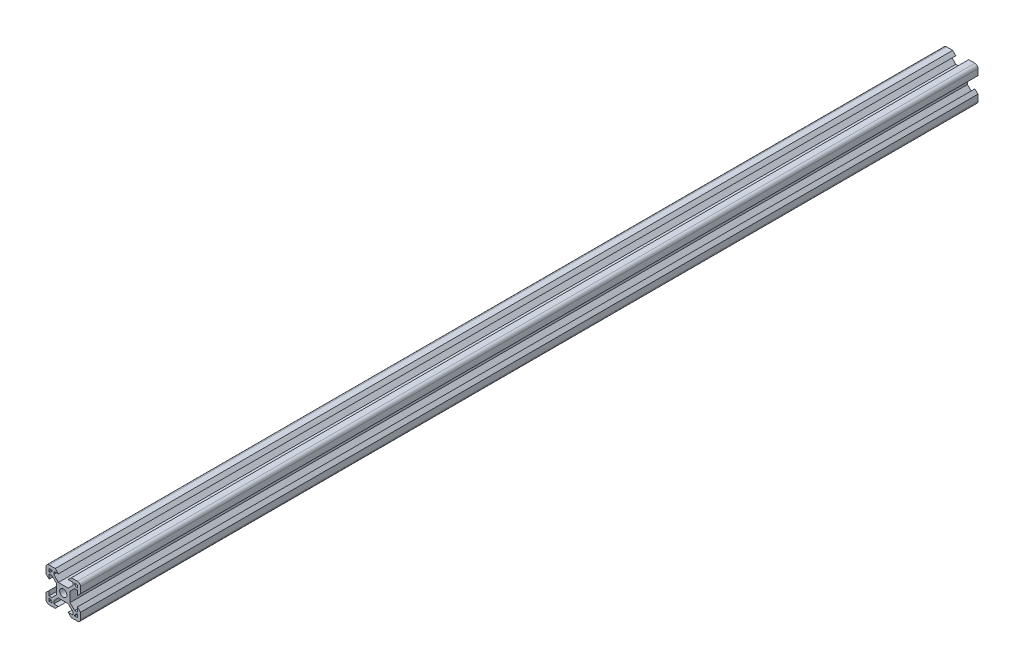
from build123d import *

# Parameters (mm, degrees)
SKETCH1_R      = 2.1
EXTRUDE1_DEPTH = 259.75


with BuildPart() as part:
    # Sketch1 → Extrude1 (new, symmetric)
    with BuildSketch(Plane.XY):
        with BuildLine():
            Line((-3.900660172, 0), (-3.900660172, -2.84))
            Line((-3.900660172, -2.84), (-6.56, -5.499339828))
            Line((-6.56, -5.499339828), (-8.2, -5.499339828))
            Line((-8.2, -5.499339828), (-8.2, -2.84))
            Line((-8.2, -2.84), (-10, -4.64))
            Line((-10, -4.64), (-10, -8.2))
            ThreePointArc((-10, -8.2), (-9.472792206, -9.472792206), (-8.2, -10))
            Line((-8.2, -10), (-4.64, -10))
            Line((-4.64, -10), (-2.84, -8.2))
            Line((-2.84, -8.2), (-5.499339828, -8.2))
            Line((-5.499339828, -8.2), (-5.499339828, -6.56))
            Line((-5.499339828, -6.56), (-2.84, -3.900660172))
            Line((-2.84, -3.900660172), (0, -3.900660172))
            Line((0, -3.900660172), (2.84, -3.900660172))
            Line((2.84, -3.900660172), (5.499339828, -6.56))
            Line((5.499339828, -6.56), (5.499339828, -8.2))
            Line((5.499339828, -8.2), (2.84, -8.2))
            Line((2.84, -8.2), (4.64, -10))
            Line((4.64, -10), (8.2, -10))
            ThreePointArc((8.2, -10), (9.472792206, -9.472792206), (10, -8.2))
            Line((10, -8.2), (10, -4.64))
            Line((10, -4.64), (8.2, -2.84))
            Line((8.2, -2.84), (8.2, -5.499339828))
            Line((8.2, -5.499339828), (6.56, -5.499339828))
            Line((6.56, -5.499339828), (3.900660172, -2.84))
            Line((3.900660172, -2.84), (3.900660172, 0))
            Line((3.900660172, 0), (3.900660172, 2.84))
            Line((3.900660172, 2.84), (6.56, 5.499339828))
            Line((6.56, 5.499339828), (8.2, 5.499339828))
            Line((8.2, 5.499339828), (8.2, 2.84))
            Line((8.2, 2.84), (10, 4.64))
            Line((10, 4.64), (10, 8.2))
            ThreePointArc((10, 8.2), (9.472792206, 9.472792206), (8.2, 10))
            Line((8.2, 10), (4.64, 10))
            Line((4.64, 10), (2.84, 8.2))
            Line((2.84, 8.2), (5.499339828, 8.2))
            Line((5.499339828, 8.2), (5.499339828, 6.56))
            Line((5.499339828, 6.56), (2.84, 3.900660172))
            Line((2.84, 3.900660172), (0, 3.900660172))
            Line((0, 3.900660172), (-2.84, 3.900660172))
            Line((-2.84, 3.900660172), (-5.499339828, 6.56))
            Line((-5.499339828, 6.56), (-5.499339828, 8.2))
            Line((-5.499339828, 8.2), (-2.84, 8.2))
            Line((-2.84, 8.2), (-4.64, 10))
            Line((-4.64, 10), (-8.2, 10))
            ThreePointArc((-8.2, 10), (-9.472792206, 9.472792206), (-10, 8.2))
            Line((-10, 8.2), (-10, 4.64))
            Line((-10, 4.64), (-8.2, 2.84))
            Line((-8.2, 2.84), (-8.2, 5.499339828))
            Line((-8.2, 5.499339828), (-6.56, 5.499339828))
            Line((-6.56, 5.499339828), (-3.900660172, 2.84))
            Line((-3.900660172, 2.84), (-3.900660172, 0))
        make_face()
        Circle(SKETCH1_R, mode=Mode.SUBTRACT)
        Polygon((-8.2, -8.2), (-8.2, -6.569339828), (-7.63, -6.569339828), (-6.569339828, -7.63), (-6.569339828, -8.2), align=None, mode=Mode.SUBTRACT)
        Polygon((-8.2, 6.569339828), (-8.2, 8.2), (-6.569339828, 8.2), (-6.569339828, 7.63), (-7.63, 6.569339828), align=None, mode=Mode.SUBTRACT)
        Polygon((6.569339828, 8.2), (8.2, 8.2), (8.2, 6.569339828), (7.63, 6.569339828), (6.569339828, 7.63), align=None, mode=Mode.SUBTRACT)
        Polygon((8.2, -6.569339828), (8.2, -8.2), (6.569339828, -8.2), (6.569339828, -7.63), (7.63, -6.569339828), align=None, mode=Mode.SUBTRACT)
    extrude(amount=EXTRUDE1_DEPTH, both=True)


solid = part.part
